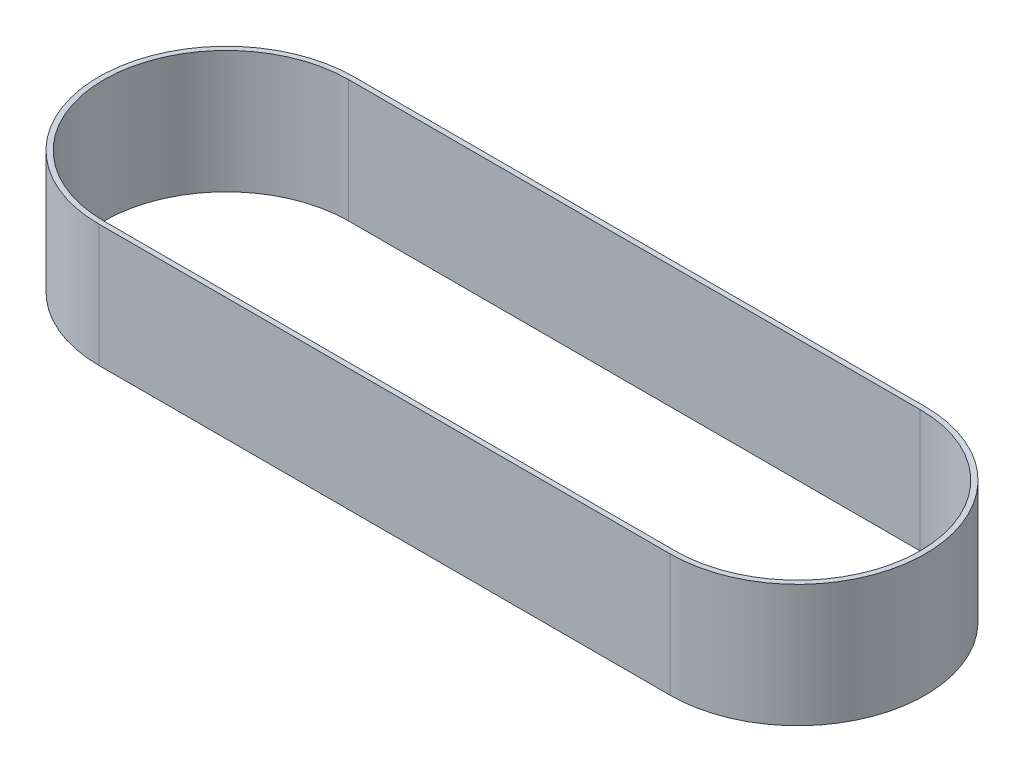
from build123d import *

# Parameters (mm, degrees)
SKIZZE3_W                       = 1400
SKIZZE3_H                       = 625
AUFSATZ_LINEAR_AUSTRAGEN1_DEPTH = 300
SKIZZE4_R                       = 312.5
AUFSATZ_LINEAR_AUSTRAGEN2_DEPTH = 300
SKIZZE5_W                       = 1400
SKIZZE5_H                       = 600
SCHNITT_LINEAR_AUSTRAGEN1_DEPTH = 1102.277667076
SKIZZE6_R                       = 300
SCHNITT_LINEAR_AUSTRAGEN2_DEPTH = 1102.277667076


with BuildPart() as part:
    # Skizze3 → Aufsatz-Linear austragen1 (new body)
    with BuildSketch(Plane(origin=(0, 0, 0), x_dir=(1, 0, 0), z_dir=(0, 1, 0))):
        Rectangle(SKIZZE3_W, SKIZZE3_H)
    extrude(amount=AUFSATZ_LINEAR_AUSTRAGEN1_DEPTH)

    # Skizze4 → Aufsatz-Linear austragen2 (add)
    with BuildSketch(Plane(origin=(0, 0, 0), x_dir=(1, 0, 0), z_dir=(0, 1, 0))):
        with Locations((-700, 0)):
            Circle(SKIZZE4_R)
    aufsatz_linear_austragen2 = extrude(amount=AUFSATZ_LINEAR_AUSTRAGEN2_DEPTH)

    # Spiegeln1: Aufsatz-Linear austragen2 across plane
    add(aufsatz_linear_austragen2.mirror(Plane(origin=(0, 0, 0), x_dir=(0, 0, 1), z_dir=(1, 0, 0))))

    # Skizze5 → Schnitt-Linear austragen1 (cut, through all)
    with BuildSketch(Plane(origin=(0, 300, 0), x_dir=(1, 0, 0), z_dir=(0, 1, 0))):
        Rectangle(SKIZZE5_W, SKIZZE5_H)
    extrude(amount=-SCHNITT_LINEAR_AUSTRAGEN1_DEPTH, mode=Mode.SUBTRACT)

    # Skizze6 → Schnitt-Linear austragen2 (cut, through all)
    with BuildSketch(Plane(origin=(0, 300, 0), x_dir=(1, 0, 0), z_dir=(0, 1, 0))):
        with Locations((-700, 0)):
            Circle(SKIZZE6_R)
    schnitt_linear_austragen2 = extrude(amount=-SCHNITT_LINEAR_AUSTRAGEN2_DEPTH, mode=Mode.SUBTRACT)

    # Spiegeln2: Schnitt-Linear austragen2 across plane
    add(schnitt_linear_austragen2.mirror(Plane(origin=(0, 0, 0), x_dir=(0, 0, 1), z_dir=(1, 0, 0))), mode=Mode.SUBTRACT)


solid = part.part
